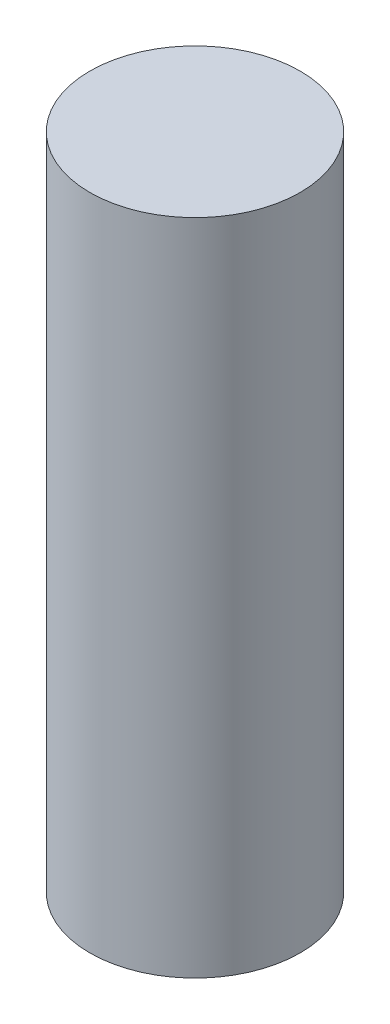
from build123d import *

# Parameters (mm, degrees)
SKETCH1_R           = 12.3317
BOSS_EXTRUDE1_DEPTH = 77.216


with BuildPart() as part:
    # Sketch1 → Boss-Extrude1 (new body)
    with BuildSketch(Plane(origin=(0, 0, 0), x_dir=(1, 0, 0), z_dir=(0, 1, 0))):
        with Locations(Location((0, 0, 0), (0, 0, 270))):
            Circle(SKETCH1_R)
    extrude(amount=BOSS_EXTRUDE1_DEPTH)


solid = part.part
